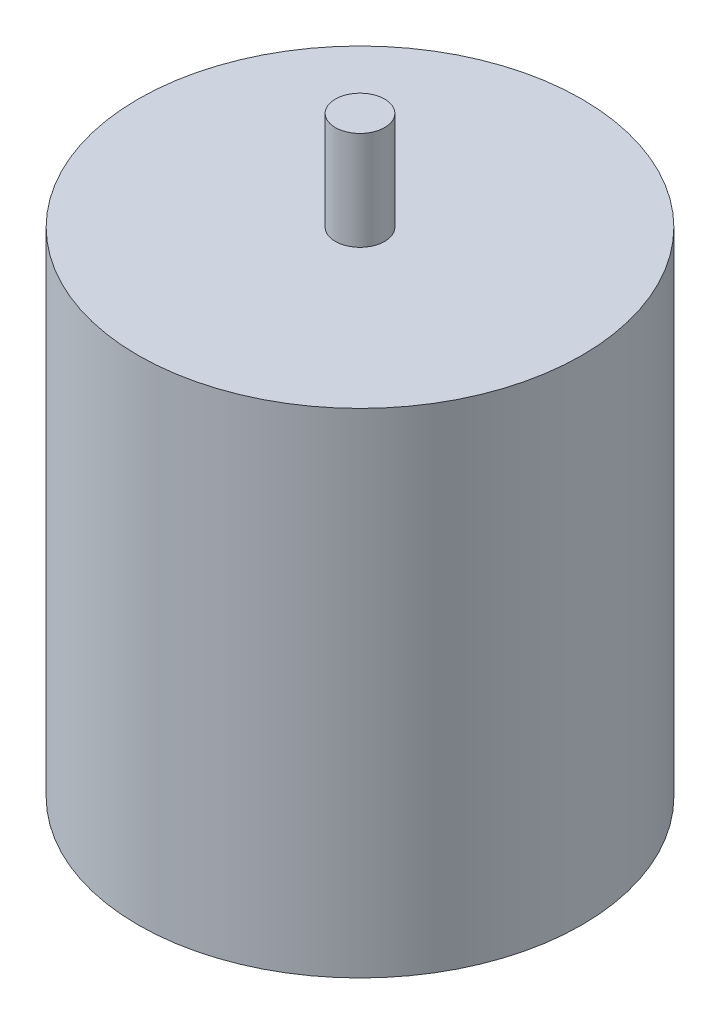
from build123d import *

# Parameters (mm, degrees)
ESQUISSE1_R        = 44.995085567
BOSS_EXTRU_1_DEPTH = 100
ESQUISSE2_R        = 5
BOSS_EXTRU_2_DEPTH = 20


with BuildPart() as part:
    # Esquisse1 → Boss.-Extru.1 (new body)
    with BuildSketch(Plane(origin=(0, 0, 0), x_dir=(1, 0, 0), z_dir=(0, 1, 0))):
        with Locations(Location((0, 0, 0), (0, 0, 270))):
            Circle(ESQUISSE1_R)
    extrude(amount=BOSS_EXTRU_1_DEPTH)

    # Esquisse2 → Boss.-Extru.2 (add)
    with BuildSketch(Plane(origin=(0, 100, 0), x_dir=(1, 0, 0), z_dir=(0, 1, 0))):
        with Locations(Location((0, 0, 0), (0, 0, 270))):
            Circle(ESQUISSE2_R)
    extrude(amount=BOSS_EXTRU_2_DEPTH)


solid = part.part
